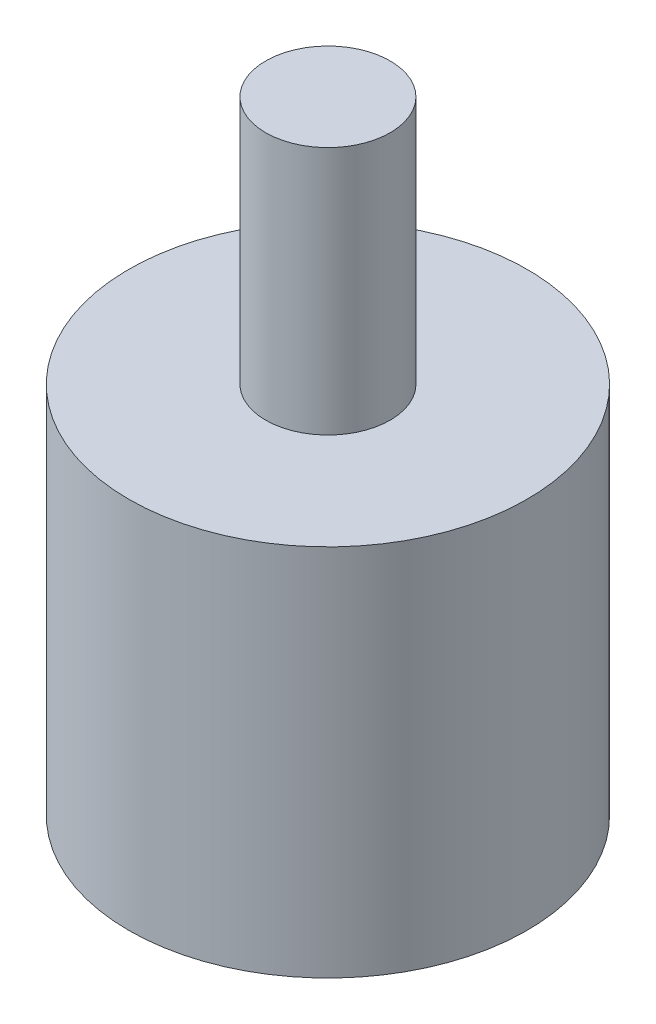
from build123d import *

# Parameters (mm, degrees)
CROQUIS1_R              = 8
SALIENTE_EXTRUIR1_DEPTH = 15
CROQUIS2_R              = 2.5
SALIENTE_EXTRUIR2_DEPTH = 10


with BuildPart() as part:
    # Croquis1 → Saliente-Extruir1 (new body)
    with BuildSketch(Plane(origin=(0, 0, 0), x_dir=(1, 0, 0), z_dir=(0, 1, 0))):
        with Locations(Location((0, 0, 0), (0, 0, 270))):
            Circle(CROQUIS1_R)
    extrude(amount=SALIENTE_EXTRUIR1_DEPTH)

    # Croquis2 → Saliente-Extruir2 (add)
    with BuildSketch(Plane(origin=(0, 15, 0), x_dir=(1, 0, 0), z_dir=(0, 1, 0))):
        with Locations(Location((0, 0, 0), (0, 0, 270))):
            Circle(CROQUIS2_R)
    extrude(amount=SALIENTE_EXTRUIR2_DEPTH)


solid = part.part
